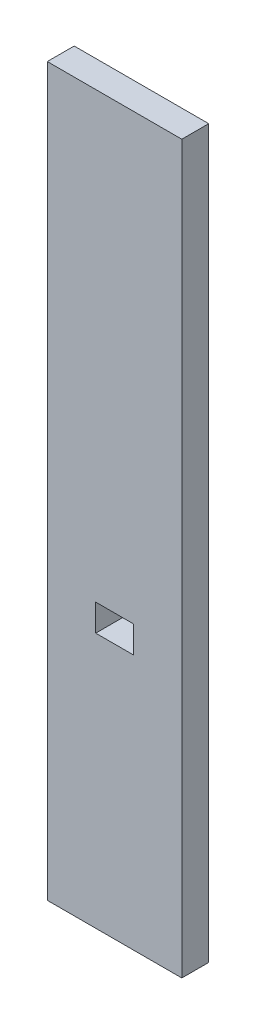
from build123d import *

# Parameters (mm, degrees)
SKETCH1_W           = 50
SKETCH1_H           = 270
BOSS_EXTRUDE1_DEPTH = 10
SKETCH2_W           = 14
SKETCH2_H           = 10
CUT_EXTRUDE1_DEPTH  = 138.658998979


with BuildPart() as part:
    # Sketch1 → Boss-Extrude1 (new body)
    with BuildSketch(Plane.XY):
        Rectangle(SKETCH1_W, SKETCH1_H)
    extrude(amount=BOSS_EXTRUDE1_DEPTH)

    # Sketch2 → Cut-Extrude1 (cut, through all)
    with BuildSketch(Plane.XY.offset(10)):
        with Locations((0, -35)):
            Rectangle(SKETCH2_W, SKETCH2_H)
    extrude(amount=-CUT_EXTRUDE1_DEPTH, mode=Mode.SUBTRACT)


solid = part.part
